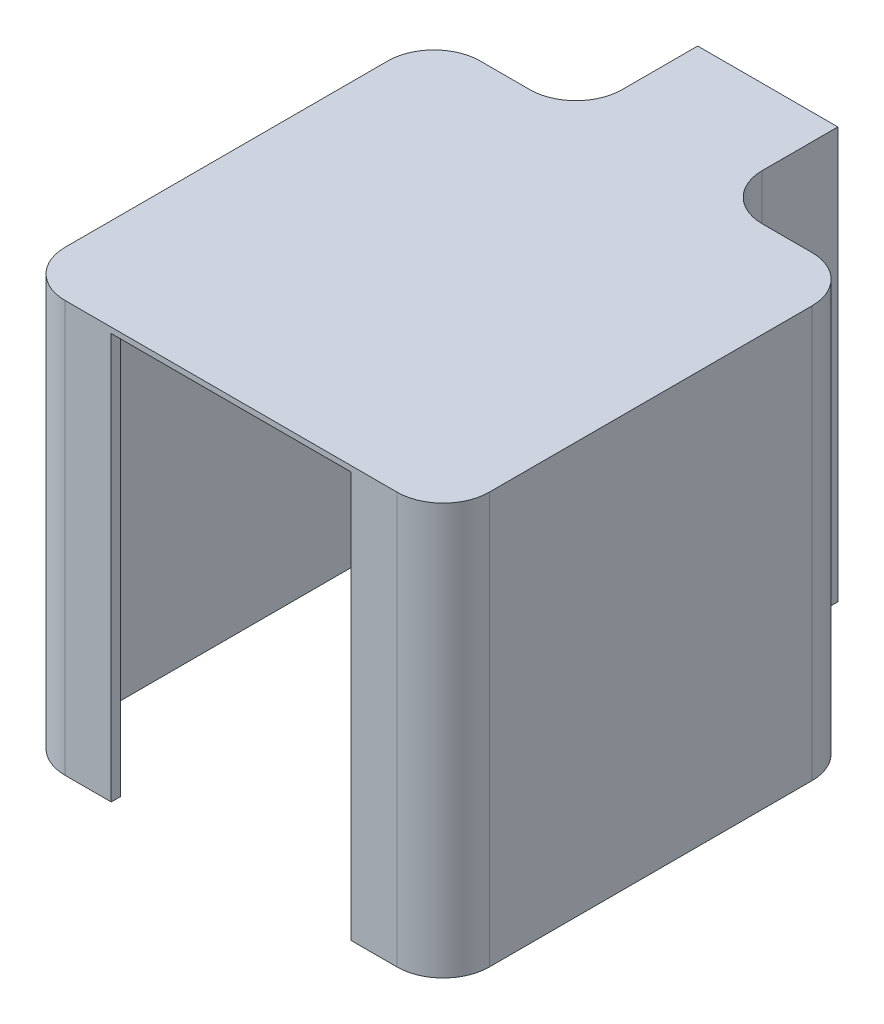
from build123d import *

# Parameters (mm, degrees)
BOSS_EXTRUDE1_DEPTH = 220
FILLET1_R           = 25
BOSS_EXTRUDE2_START = 3
BOSS_EXTRUDE2_DEPTH = 3
FILLET2_R           = 25


with BuildPart() as part:
    # Sketch1 → Boss-Extrude1 (new body)
    with BuildSketch(Plane(origin=(0, 0, 0), x_dir=(1, 0, 0), z_dir=(0, 1, 0))):
        Polygon((33, 107.5), (110, 107.5), (110, -107.5), (65, -107.5), (65, -112.5), (115, -112.5), (115, 112.5), (38, 112.5), (38, 178.5), (-38, 178.5), (-38, 112.5), (-115, 112.5), (-115, -112.5), (-65, -112.5), (-65, -107.5), (-110, -107.5), (-110, 107.5), (-33, 107.5), (-33, 173.5), (33, 173.5), align=None)
    extrude(amount=BOSS_EXTRUDE1_DEPTH)

    # Fillet1
    fillet1_edges = [part.edges().sort_by_distance(p)[0] for p in [
        (33, 110, -107.5),
        (-33, 110, -107.5),
        (-38, 110, -112.5),
        (38, 110, -112.5),
    ]]
    fillet(fillet1_edges, radius=FILLET1_R)

    # Sketch2 → Boss-Extrude2 (add)
    with BuildSketch(Plane(origin=(0, 220, 0), x_dir=(1, 0, 0), z_dir=(0, 1, 0)).offset(BOSS_EXTRUDE2_START)):
        with BuildLine():
            Line((-115, -112.5), (115, -112.5))
            Line((115, -112.5), (115, 112.5))
            Line((115, 112.5), (63, 112.5))
            ThreePointArc((63, 112.5), (45.32233047, 119.82233047), (38, 137.5))
            Line((38, 137.5), (38, 178.5))
            Line((38, 178.5), (-38, 178.5))
            Line((-38, 178.5), (-38, 137.5))
            ThreePointArc((-38, 137.5), (-45.32233047, 119.82233047), (-63, 112.5))
            Line((-63, 112.5), (-115, 112.5))
            Line((-115, 112.5), (-115, -112.5))
        make_face()
    extrude(amount=-BOSS_EXTRUDE2_DEPTH)

    # Fillet2
    fillet2_edges = [part.edges().sort_by_distance(p)[0] for p in [
        (110, 110, 107.5),
        (110, 110, -107.5),
        (-110, 110, -107.5),
        (-110, 110, 107.5),
        (-115, 111.5, 112.5),
        (-115, 111.5, -112.5),
        (115, 111.5, -112.5),
        (115, 111.5, 112.5),
    ]]
    fillet(fillet2_edges, radius=FILLET2_R)


solid = part.part
